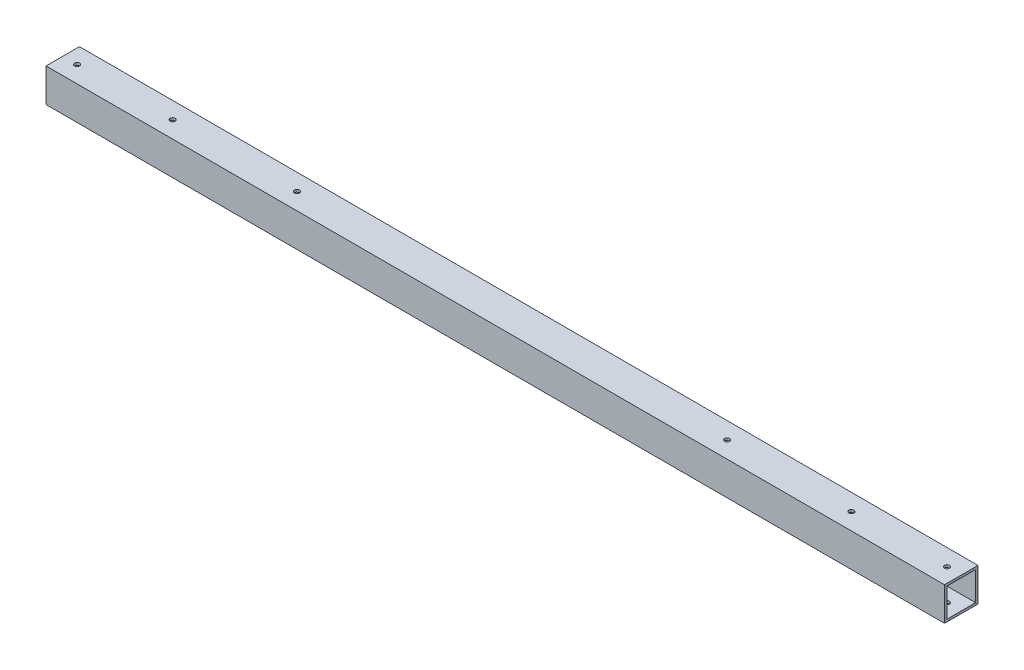
from build123d import *

# Parameters (mm, degrees)
SKETCH1_W               = 44.45
SKETCH1_H               = 44.45
SKETCH1_W_2             = 38.1
SKETCH1_H_2             = 38.1
BOSS_EXTRUDE1_DEPTH     = 1193.8
F_1_4_CLEARANCE_HOLE1_D = 6.7564


with BuildPart() as part:
    # Sketch1 → Boss-Extrude1 (new body)
    with BuildSketch(Plane(origin=(0, 0, 0), x_dir=(0, 0, -1), z_dir=(1, 0, 0))):
        Rectangle(SKETCH1_W, SKETCH1_H)
        Rectangle(SKETCH1_W_2, SKETCH1_H_2, mode=Mode.SUBTRACT)
    extrude(amount=BOSS_EXTRUDE1_DEPTH)

    # 1/4 Clearance Hole1 (through all)
    with Locations(Plane(origin=(0, 22.225, 0), x_dir=(1, 0, 0), z_dir=(0, 1, 0))):
        with Locations((311.15, 0), (146.05, 0), (19.05, 0), (1174.75, 0), (1047.75, 0), (882.65, 0)):
            Hole(F_1_4_CLEARANCE_HOLE1_D / 2)


solid = part.part
